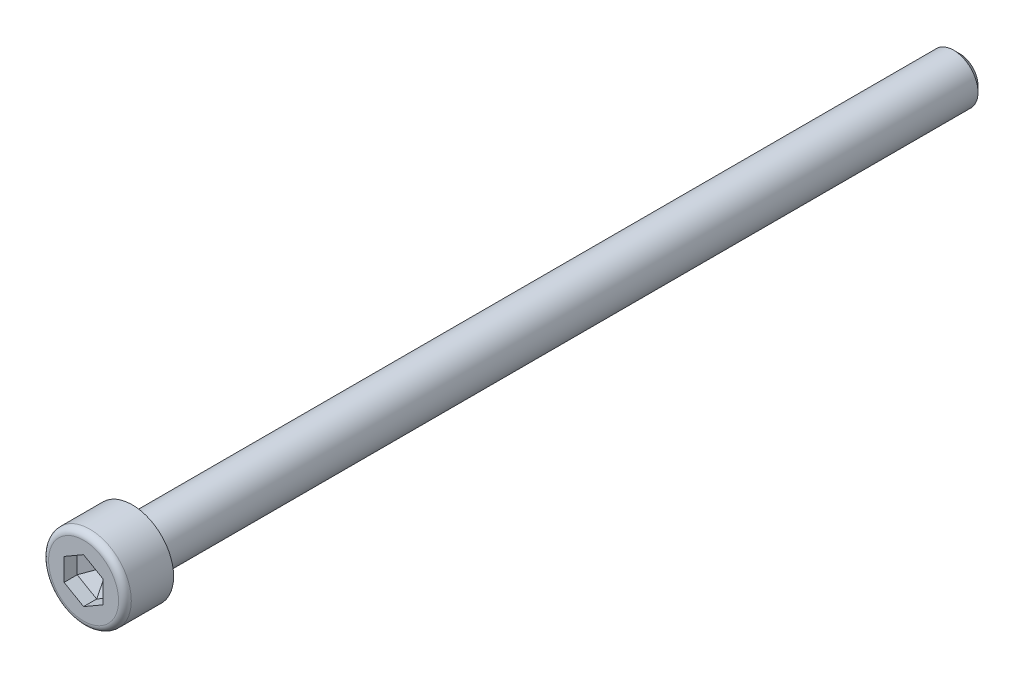
from build123d import *
from OCP.BRepFilletAPI import BRepFilletAPI_MakeChamfer

# Parameters (mm, degrees)
SKETCH_1_R          = 4.25
EXTRUDE_1_DEPTH     = 5
CUT_EXTRUDE_1_DEPTH = 2.5
SKETCH_3_R          = 2.5
EXTRUDE_2_DEPTH     = 85
CHAMFER_1_SIZE      = 0.625
FILLET_1_R          = 0.653846154
CHAMFER_2_SIZE      = 1.152737752
CHAMFER_2_SIZE2     = 1.996600355
FILLET_2_R          = 0.1


with BuildPart() as part:
    # 草图1 → 凸台-拉伸1 (new body)
    with BuildSketch(Plane.XY):
        Circle(SKETCH_1_R)
    extrude(amount=EXTRUDE_1_DEPTH)

    # 草图2 → 切除-拉伸1 (cut)
    with BuildSketch(Plane.XY.offset(5)):
        Polygon((2, 1.154700538), (0, 2.309401077), (-2, 1.154700538), (-2, -1.154700538), (0, -2.309401077), (2, -1.154700538), align=None)
    extrude(amount=-CUT_EXTRUDE_1_DEPTH, mode=Mode.SUBTRACT)

    # 草图3 → 凸台-拉伸2 (add)
    with BuildSketch(Plane(origin=(0, 0, 0), x_dir=(-1, 0, 0), z_dir=(0, 0, -1))):
        Circle(SKETCH_3_R)
    extrude(amount=EXTRUDE_2_DEPTH)

    # 倒角1
    chamfer_1_edges = [part.edges().sort_by_distance(p)[0] for p in [
        (2.5, 0, -85),
    ]]
    chamfer(chamfer_1_edges, length=CHAMFER_1_SIZE)

    # 圆角1
    fillet_1_edges = [part.edges().sort_by_distance(p)[0] for p in [
        (-4.25, 0, 5),
    ]]
    fillet(fillet_1_edges, radius=FILLET_1_R)

    # 倒角2: one chamfer whose edges measure the first distance from different faces: ONE call of the kernel's chamfer builder (chamfer() names one face for all edges)
    chamfer_2_edges_1 = [part.edges().sort_by_distance(p)[0] for p in [
        (-2, 0, 2.5),
    ]]
    chamfer_2_side_1 = [part.faces().sort_by_distance(p)[0] for p in [
        (-2, 0, 3.75),
    ]]
    chamfer_2_edges_2 = [part.edges().sort_by_distance(p)[0] for p in [
        (-1, 1.732050808, 2.5),
    ]]
    chamfer_2_side_2 = [part.faces().sort_by_distance(p)[0] for p in [
        (-1, 1.732050808, 3.75),
    ]]
    chamfer_2_edges_3 = [part.edges().sort_by_distance(p)[0] for p in [
        (1, 1.732050808, 2.5),
    ]]
    chamfer_2_side_3 = [part.faces().sort_by_distance(p)[0] for p in [
        (1, 1.732050808, 3.75),
    ]]
    chamfer_2_edges_4 = [part.edges().sort_by_distance(p)[0] for p in [
        (2, 0, 2.5),
    ]]
    chamfer_2_side_4 = [part.faces().sort_by_distance(p)[0] for p in [
        (2, 0, 3.75),
    ]]
    chamfer_2_edges_5 = [part.edges().sort_by_distance(p)[0] for p in [
        (-1, -1.732050808, 2.5),
    ]]
    chamfer_2_side_5 = [part.faces().sort_by_distance(p)[0] for p in [
        (-1, -1.732050808, 3.75),
    ]]
    chamfer_2_edges_6 = [part.edges().sort_by_distance(p)[0] for p in [
        (1, -1.732050808, 2.5),
    ]]
    chamfer_2_side_6 = [part.faces().sort_by_distance(p)[0] for p in [
        (1, -1.732050808, 3.75),
    ]]
    chamfer_2 = BRepFilletAPI_MakeChamfer(part.part.solid().wrapped)
    for e in chamfer_2_edges_1:
        chamfer_2.Add(CHAMFER_2_SIZE, CHAMFER_2_SIZE2, e.wrapped, chamfer_2_side_1[0].wrapped)  # the first distance lies on this face
    for e in chamfer_2_edges_2:
        chamfer_2.Add(CHAMFER_2_SIZE, CHAMFER_2_SIZE2, e.wrapped, chamfer_2_side_2[0].wrapped)  # the first distance lies on this face
    for e in chamfer_2_edges_3:
        chamfer_2.Add(CHAMFER_2_SIZE, CHAMFER_2_SIZE2, e.wrapped, chamfer_2_side_3[0].wrapped)  # the first distance lies on this face
    for e in chamfer_2_edges_4:
        chamfer_2.Add(CHAMFER_2_SIZE, CHAMFER_2_SIZE2, e.wrapped, chamfer_2_side_4[0].wrapped)  # the first distance lies on this face
    for e in chamfer_2_edges_5:
        chamfer_2.Add(CHAMFER_2_SIZE, CHAMFER_2_SIZE2, e.wrapped, chamfer_2_side_5[0].wrapped)  # the first distance lies on this face
    for e in chamfer_2_edges_6:
        chamfer_2.Add(CHAMFER_2_SIZE, CHAMFER_2_SIZE2, e.wrapped, chamfer_2_side_6[0].wrapped)  # the first distance lies on this face
    add(Compound.cast(chamfer_2.Shape()), mode=Mode.REPLACE)

    # 圆角2
    fillet_2_edges = [part.edges().sort_by_distance(p)[0] for p in [
        (2.5, 0, 0),
    ]]
    fillet(fillet_2_edges, radius=FILLET_2_R)


solid = part.part
